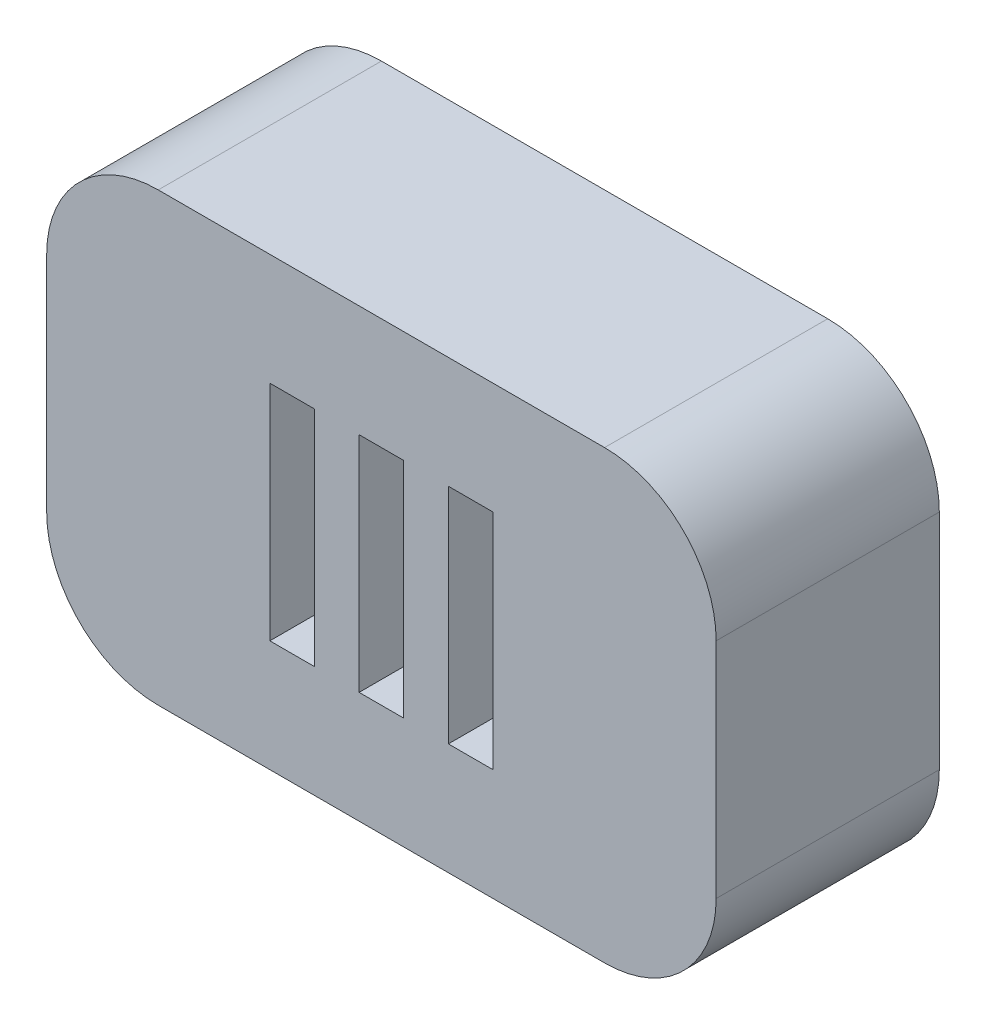
from build123d import *

# Parameters (mm, degrees)
AUFSATZ_LINEAR_AUSTRAGEN1_DEPTH = 2
SKIZZE2_W                       = 0.4
SKIZZE2_H                       = 2
SCHNITT_LINEAR_AUSTRAGEN1_DEPTH = 1
SKIZZE3_W                       = 0.4
SKIZZE3_H                       = 2
SCHNITT_LINEAR_AUSTRAGEN2_DEPTH = 1
SKIZZE4_W                       = 0.4
SKIZZE4_H                       = 2
SCHNITT_LINEAR_AUSTRAGEN3_DEPTH = 1


with BuildPart() as part:
    # Skizze1 → Aufsatz-Linear austragen1 (new body)
    with BuildSketch(Plane.XY):
        with BuildLine():
            Line((1, 0), (5, 0))
            ThreePointArc((5, 0), (5.707106781, 0.292893219), (6, 1))
            Line((6, 1), (6, 3))
            ThreePointArc((6, 3), (5.707106781, 3.707106781), (5, 4))
            Line((5, 4), (1, 4))
            ThreePointArc((1, 4), (0.292893219, 3.707106781), (0, 3))
            Line((0, 3), (0, 1))
            ThreePointArc((0, 1), (0.292893219, 0.292893219), (1, 0))
        make_face()
    extrude(amount=AUFSATZ_LINEAR_AUSTRAGEN1_DEPTH)

    # Skizze2 → Schnitt-Linear austragen1 (cut)
    with BuildSketch(Plane.XY.offset(2)):
        with Locations((3, 2)):
            Rectangle(SKIZZE2_W, SKIZZE2_H)
    extrude(amount=-SCHNITT_LINEAR_AUSTRAGEN1_DEPTH, mode=Mode.SUBTRACT)

    # Skizze3 → Schnitt-Linear austragen2 (cut)
    with BuildSketch(Plane.XY.offset(2)):
        with Locations((3.8, 2)):
            Rectangle(SKIZZE3_W, SKIZZE3_H)
    extrude(amount=-SCHNITT_LINEAR_AUSTRAGEN2_DEPTH, mode=Mode.SUBTRACT)

    # Skizze4 → Schnitt-Linear austragen3 (cut)
    with BuildSketch(Plane.XY.offset(2)):
        with Locations((2.2, 2)):
            Rectangle(SKIZZE4_W, SKIZZE4_H)
    extrude(amount=-SCHNITT_LINEAR_AUSTRAGEN3_DEPTH, mode=Mode.SUBTRACT)


solid = part.part
